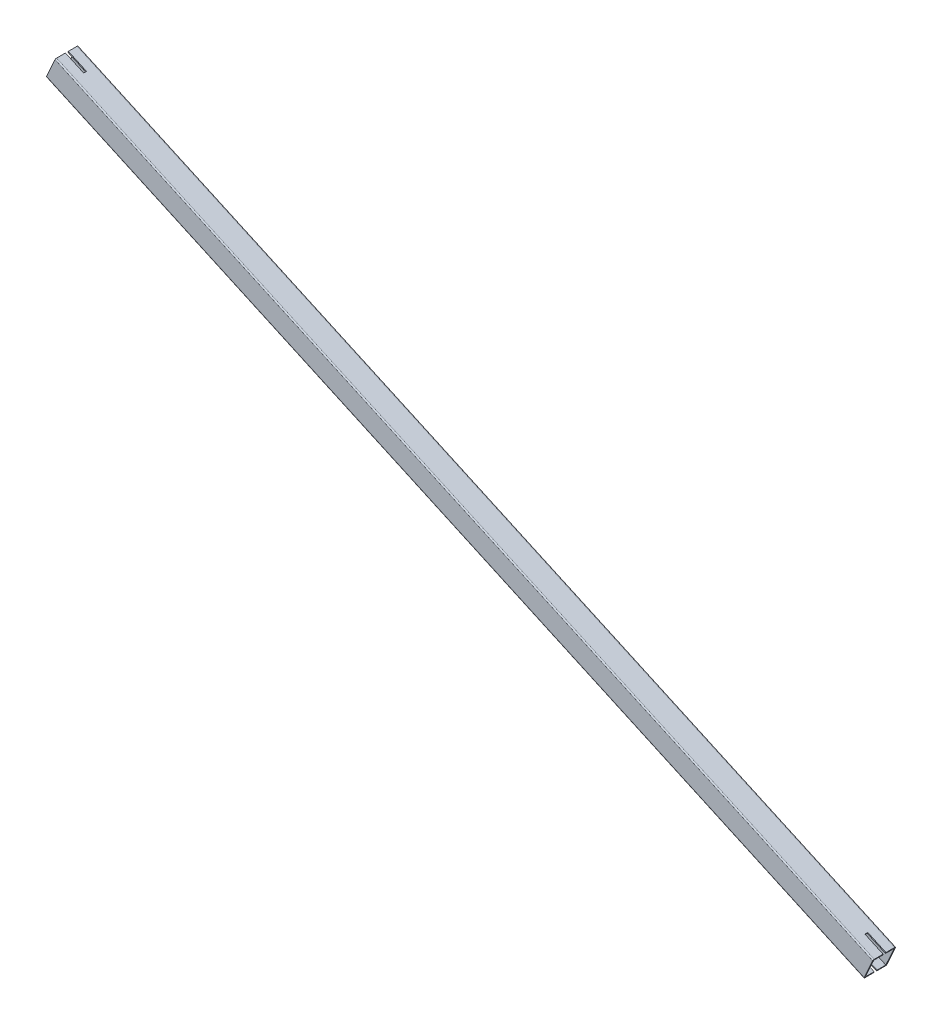
from build123d import *

# Parameters (mm, degrees)
F_8639_82_80_X_80_X_4_0_1_DEPTH = 3150
SKETCH_3_W                      = 70
SKETCH_3_H                      = 10
CUT_EXTRUDE_1_DEPTH             = 3181.418039206


with BuildPart() as part:
    # Sketch11 → Квадратная труба гост 8639-82 _80 X 80 X 4.0(1) (new body)
    with BuildSketch(Plane(origin=(0, 0, 0), x_dir=(0.413802944301184, 0.9103664774626047, 0), z_dir=(0.9103664774626047, -0.413802944301184, 0))):
        with BuildLine():
            Line((-35.999, -40), (35.999, -40))
            ThreePointArc((35.999, -40), (38.828134232, -38.828134232), (40, -35.999))
            Line((40, -35.999), (40, 35.999))
            ThreePointArc((40, 35.999), (38.828134232, 38.828134232), (35.999, 40))
            Line((35.999, 40), (-35.999, 40))
            ThreePointArc((-35.999, 40), (-38.828134232, 38.828134232), (-40, 35.999))
            Line((-40, 35.999), (-40, -35.999))
            ThreePointArc((-40, -35.999), (-38.828134232, -38.828134232), (-35.999, -40))
        make_face()
        with BuildLine():
            Line((-35.999, -36), (35.999, -36))
            ThreePointArc((35.999, -36), (35.999707107, -35.999707107), (36, -35.999))
            Line((36, -35.999), (36, 35.999))
            ThreePointArc((36, 35.999), (35.999707107, 35.999707107), (35.999, 36))
            Line((35.999, 36), (-35.999, 36))
            ThreePointArc((-35.999, 36), (-35.999707107, 35.999707107), (-36, 35.999))
            Line((-36, 35.999), (-36, -35.999))
            ThreePointArc((-36, -35.999), (-35.999707107, -35.999707107), (-35.999, -36))
        make_face(mode=Mode.SUBTRACT)
    extrude(amount=F_8639_82_80_X_80_X_4_0_1_DEPTH)

    # Эскиз3 → Вырез-Вытянуть1 (cut, through all)
    with BuildSketch(Plane(origin=(-16.552117772, -36.414659099, 0), x_dir=(0.9103664774626047, -0.413802944301184, 0), z_dir=(-0.41380294430118403, -0.9103664774626048, 0))):
        with Locations((35, 0)):
            Rectangle(SKETCH_3_W, SKETCH_3_H)
        with Locations((3115, 0)):
            Rectangle(SKETCH_3_W, SKETCH_3_H)
    extrude(amount=-CUT_EXTRUDE_1_DEPTH, mode=Mode.SUBTRACT)


solid = part.part
